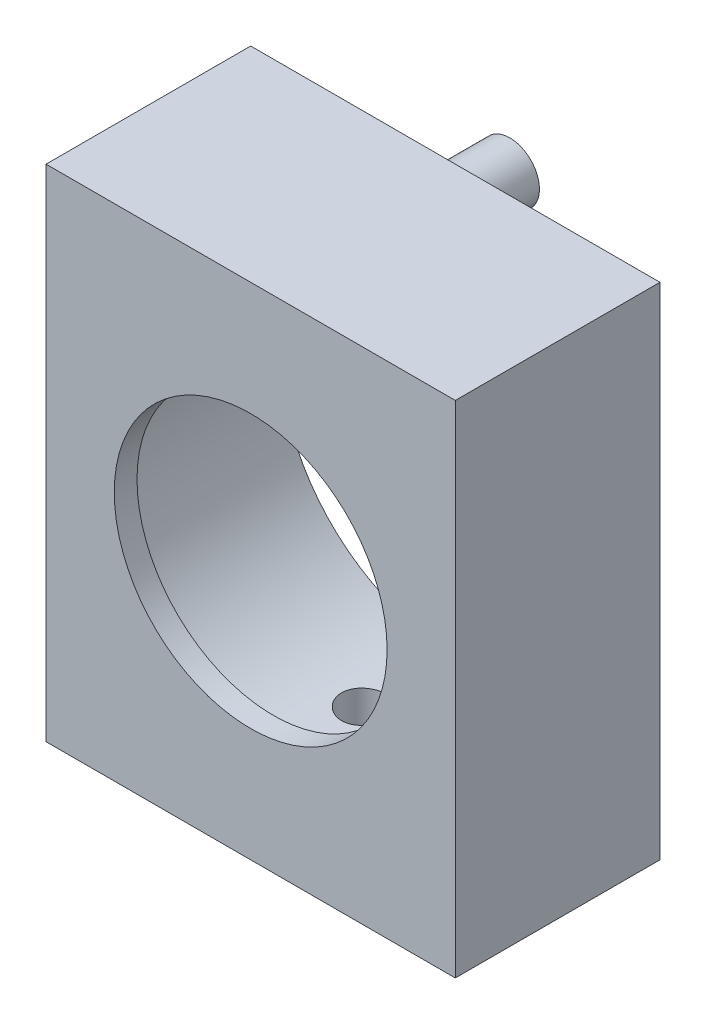
from build123d import *

# Parameters (mm, degrees)
ESBO_O6_R                  = 5.25
ESBO_O6_R_2                = 4.1
RESSALTO_EXTRUS_O3_DEPTH   = 4
ESBO_O7_R                  = 5.25
RESSALTO_EXTRUS_O4_DEPTH   = 0.5
ESBO_O9_R                  = 0.65
RESSALTO_EXTRUS_O5_DEPTH   = 1.2
ESBO_O12_R                 = 3
CORTE_EXTRUS_O5_DEPTH      = 10
RESSALTO_EXTRUS_O6_START   = 4
ESBO_O13_R                 = 4.1
ESBO_O13_R_2               = 3.85
RESSALTO_EXTRUS_O6_DEPTH   = 4
ESBO_O16_W                 = 2.665336127
ESBO_O16_H                 = 7.90902753
ESBO_O16_W_2               = 2.097265449
ESBO_O16_H_2               = 7.395164159
CORTE_EXTRUS_O7_DEPTH      = 10
ESBO_O15_W                 = 9
ESBO_O15_H                 = 11
ESBO_O15_R                 = 3.85
RESSALTO_EXTRUS_O7_DEPTH   = 4.5
CORTE_EXTRUS_O6_REACH      = 18.756
CORTE_EXTRUS_O6_END_RADIUS = 3.85
ESBO_O14_R                 = 0.5


with BuildPart() as part:
    # Esboço6 → Ressalto-extrusão3 (new body)
    with BuildSketch(Plane.XY):
        Circle(ESBO_O6_R)
        Circle(ESBO_O6_R_2, mode=Mode.SUBTRACT)
    extrude(amount=RESSALTO_EXTRUS_O3_DEPTH)

    # Esboço7 → Ressalto-extrusão4 (add)
    with BuildSketch(Plane.XY.offset(4)):
        Circle(ESBO_O7_R)
    extrude(amount=RESSALTO_EXTRUS_O4_DEPTH)

    # Esboço9 → Ressalto-extrusão5 (add)
    with BuildSketch(Plane(origin=(0, 0, 0), x_dir=(-1, 0, 0), z_dir=(0, 0, -1))):
        with Locations(Location((0, 4.75, 0), (0, 0, 132.158106499))):
            Circle(ESBO_O9_R)
        with Locations(Location((0, -4.75, 0), (0, 0, 227.841893501))):
            Circle(ESBO_O9_R)
    extrude(amount=RESSALTO_EXTRUS_O5_DEPTH)

    # Esboço12 → Corte-extrusão5 (cut)
    with BuildSketch(Plane(origin=(0, 0, 4), x_dir=(-1, 0, 0), z_dir=(0, 0, -1))):
        Circle(ESBO_O12_R)
    extrude(amount=-CORTE_EXTRUS_O5_DEPTH, mode=Mode.SUBTRACT)

    # Esboço13 → Ressalto-extrusão6 (add)
    with BuildSketch(Plane(origin=(0, 0, 4), x_dir=(-1, 0, 0), z_dir=(0, 0, -1)).offset(RESSALTO_EXTRUS_O6_START)):
        Circle(ESBO_O13_R)
        with Locations(Location((0, 0, 0), (0, 0, 180))):
            Circle(ESBO_O13_R_2, mode=Mode.SUBTRACT)
    extrude(amount=-RESSALTO_EXTRUS_O6_DEPTH)

    # Esboço16 → Corte-extrusão7 (cut)
    with BuildSketch(Plane(origin=(0, 0, 0), x_dir=(-1, 0, 0), z_dir=(0, 0, -1))):
        with Locations((5.832668063, -0.340062901)):
            Rectangle(ESBO_O16_W, ESBO_O16_H)
        with Locations((-5.548632725, -0.440601387)):
            Rectangle(ESBO_O16_W_2, ESBO_O16_H_2)
    extrude(amount=-CORTE_EXTRUS_O7_DEPTH, mode=Mode.SUBTRACT)

    # Esboço15 → Ressalto-extrusão7 (add)
    with BuildSketch(Plane(origin=(0, 0, 0), x_dir=(-1, 0, 0), z_dir=(0, 0, -1))):
        Rectangle(ESBO_O15_W, ESBO_O15_H)
        with Locations(Location((0, 0, 0), (0, 0, 180))):
            Circle(ESBO_O15_R, mode=Mode.SUBTRACT)
    extrude(amount=-RESSALTO_EXTRUS_O7_DEPTH)

    # Corte-extrusão6: up to this cylinder (the profile starts outside it)
    corte_extrus_o6_end = Plane(origin=(0, 0, 2), z_dir=(0, 0, 1)) * Cylinder(CORTE_EXTRUS_O6_END_RADIUS, 46.212, mode=Mode.PRIVATE)
    # Esboço14 → Corte-extrusão6 (cut, up to the surface)
    with BuildSketch(Plane(origin=(0, -10, 0), x_dir=(1, 0, 0), z_dir=(0, 1, 0)), mode=Mode.PRIVATE) as corte_extrus_o6_sk1:
        with Locations(Location((0, -2, 0), (0, 0, 90))):
            Circle(ESBO_O14_R)
    corte_extrus_o6_tool1 = extrude(corte_extrus_o6_sk1.sketch, amount=CORTE_EXTRUS_O6_REACH, mode=Mode.PRIVATE) - corte_extrus_o6_end
    add(corte_extrus_o6_tool1.solids().sort_by_distance((0, -10, 2))[0], mode=Mode.SUBTRACT)


solid = part.part
